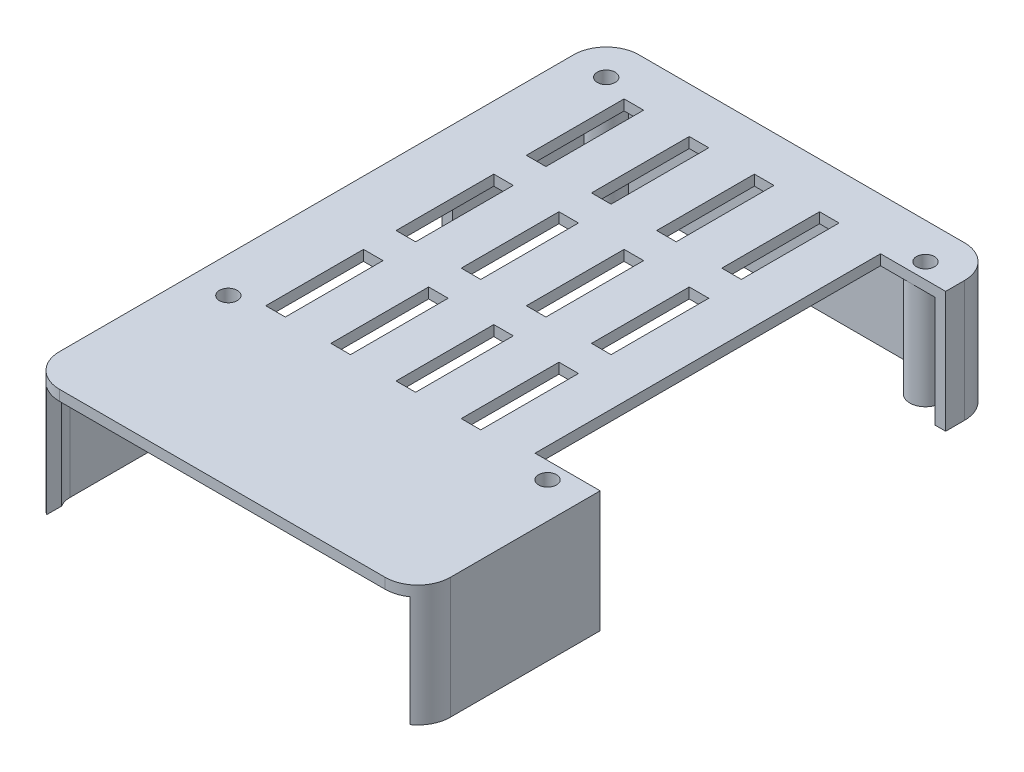
from build123d import *

# Parameters (mm, degrees)
SKETCH1_R           = 1.375
BOSS_EXTRUDE1_DEPTH = 1.6
BOSS_EXTRUDE2_START = -17
BOSS_EXTRUDE2_DEPTH = 17
BOSS_EXTRUDE3_START = -17.6
SKETCH2_R           = 2.4
SKETCH2_R_2         = 1.375
BOSS_EXTRUDE3_DEPTH = 17.6
SKETCH3_W           = 36.288172123
SKETCH3_H           = 9.00941151
CUT_EXTRUDE1_DEPTH  = 10
SKETCH5_W           = 16.770268593
SKETCH5_H           = 4.911067329
CUT_EXTRUDE2_DEPTH  = 10
SKETCH7_W           = 55
SKETCH7_H           = 17
CUT_EXTRUDE3_DEPTH  = 10
SKETCH9_W           = 3
SKETCH9_H           = 15
CUT_EXTRUDE4_DEPTH  = 10
MOVE_FACE1_BY       = 0.4
MOVE_FACE1_2_BY     = 0.4
MOVE_FACE1_3_BY     = 0.4
MOVE_FACE1_4_BY     = 0.4
MOVE_FACE1_5_BY     = 0.4
MOVE_FACE1_6_BY     = 0.4
MOVE_FACE1_7_BY     = 0.4
MOVE_FACE1_8_BY     = 0.4
MOVE_FACE1_9_BY     = 0.4
MOVE_FACE1_10_BY    = 0.4


with BuildPart() as part:
    # Sketch1 → Boss-Extrude1 (new body)
    # profile 1 of 2: a face of its own
    with BuildSketch(Plane(origin=(0, 0, 0), x_dir=(1, 0, 0), z_dir=(0, 1, 0))):
        with BuildLine():
            Line((-11.124120265, 42.72781091), (38.875879735, 42.72781091))
            ThreePointArc((38.875879735, 42.72781091), (40.997200079, 41.849131254), (41.875879735, 39.72781091))
            Line((41.875879735, 39.72781091), (41.875879735, 36.821646567))
            Line((41.875879735, 36.821646567), (33.875879735, 36.821646567))
            Line((33.875879735, 36.821646567), (33.875879735, -16.202520779))
            Line((33.875879735, -16.202520779), (41.875879735, -16.202520779))
            Line((41.875879735, -16.202520779), (41.875879735, -39.202520779))
            ThreePointArc((41.875879735, -39.202520779), (40.997200079, -41.323841123), (38.875879735, -42.202520779))
            Line((38.875879735, -42.202520779), (-11.124120265, -42.202520779))
            ThreePointArc((-11.124120265, -42.202520779), (-13.245440608, -41.323841123), (-14.124120265, -39.202520779))
            Line((-14.124120265, -39.202520779), (-14.124120265, 39.72781091))
            ThreePointArc((-14.124120265, 39.72781091), (-13.245440608, 41.849131254), (-11.124120265, 42.72781091))
        make_face()
        with Locations(Location((-10.624120265, -18.778353433, 0), (0, 0, 270))):
            Circle(SKETCH1_R, mode=Mode.SUBTRACT)
        with Locations(Location((-10.624120265, 39.221646567, 0), (0, 0, 270))):
            Circle(SKETCH1_R, mode=Mode.SUBTRACT)
        with Locations(Location((38.375879735, 39.221646567, 0), (0, 0, 270))):
            Circle(SKETCH1_R, mode=Mode.SUBTRACT)
        with Locations(Location((38.375879735, -18.778353433, 0), (0, 0, 270))):
            Circle(SKETCH1_R, mode=Mode.SUBTRACT)
    # profile 2 of 2: a face of its own
    with BuildSketch(Plane(origin=(0, 0, 0), x_dir=(1, 0, 0), z_dir=(0, 1, 0))):
        with BuildLine():
            Line((-16.124120265, -39.202520779), (-16.124120265, 39.72781091))
            ThreePointArc((-16.124120265, 39.72781091), (-14.65965417, 43.263344816), (-11.124120265, 44.72781091))
            Line((-11.124120265, 44.72781091), (38.875879735, 44.72781091))
            ThreePointArc((38.875879735, 44.72781091), (42.411413641, 43.263344816), (43.875879735, 39.72781091))
            Line((43.875879735, 39.72781091), (43.875879735, 36.821646567))
            Line((43.875879735, 36.821646567), (41.875879735, 36.821646567))
            Line((41.875879735, 36.821646567), (41.875879735, 39.72781091))
            ThreePointArc((41.875879735, 39.72781091), (40.997200079, 41.849131254), (38.875879735, 42.72781091))
            Line((38.875879735, 42.72781091), (-11.124120265, 42.72781091))
            ThreePointArc((-11.124120265, 42.72781091), (-13.245440608, 41.849131254), (-14.124120265, 39.72781091))
            Line((-14.124120265, 39.72781091), (-14.124120265, -39.202520779))
            ThreePointArc((-14.124120265, -39.202520779), (-13.245440608, -41.323841123), (-11.124120265, -42.202520779))
            Line((-11.124120265, -42.202520779), (38.875879735, -42.202520779))
            ThreePointArc((38.875879735, -42.202520779), (40.997200079, -41.323841123), (41.875879735, -39.202520779))
            Line((41.875879735, -39.202520779), (41.875879735, -16.202520779))
            Line((41.875879735, -16.202520779), (43.875879735, -16.202520779))
            Line((43.875879735, -16.202520779), (43.875879735, -39.202520779))
            ThreePointArc((43.875879735, -39.202520779), (42.411413641, -42.738054685), (38.875879735, -44.202520779))
            Line((38.875879735, -44.202520779), (-11.124120265, -44.202520779))
            ThreePointArc((-11.124120265, -44.202520779), (-14.65965417, -42.738054685), (-16.124120265, -39.202520779))
        make_face()
    extrude(amount=BOSS_EXTRUDE1_DEPTH)

    # Sketch1<3> → Boss-Extrude2 (add)
    with BuildSketch(Plane(origin=(0, 0, 0), x_dir=(1, 0, 0), z_dir=(0, 1, 0)).offset(BOSS_EXTRUDE2_START)):
        with BuildLine():
            Line((-16.124120265, -39.202520779), (-16.124120265, 39.72781091))
            ThreePointArc((-16.124120265, 39.72781091), (-14.65965417, 43.263344816), (-11.124120265, 44.72781091))
            Line((-11.124120265, 44.72781091), (38.875879735, 44.72781091))
            ThreePointArc((38.875879735, 44.72781091), (42.411413641, 43.263344816), (43.875879735, 39.72781091))
            Line((43.875879735, 39.72781091), (43.875879735, 36.821646567))
            Line((43.875879735, 36.821646567), (41.875879735, 36.821646567))
            Line((41.875879735, 36.821646567), (41.875879735, 39.72781091))
            ThreePointArc((41.875879735, 39.72781091), (40.997200079, 41.849131254), (38.875879735, 42.72781091))
            Line((38.875879735, 42.72781091), (-11.124120265, 42.72781091))
            ThreePointArc((-11.124120265, 42.72781091), (-13.245440608, 41.849131254), (-14.124120265, 39.72781091))
            Line((-14.124120265, 39.72781091), (-14.124120265, -39.202520779))
            ThreePointArc((-14.124120265, -39.202520779), (-13.245440608, -41.323841123), (-11.124120265, -42.202520779))
            Line((-11.124120265, -42.202520779), (38.875879735, -42.202520779))
            ThreePointArc((38.875879735, -42.202520779), (40.997200079, -41.323841123), (41.875879735, -39.202520779))
            Line((41.875879735, -39.202520779), (41.875879735, -16.202520779))
            Line((41.875879735, -16.202520779), (43.875879735, -16.202520779))
            Line((43.875879735, -16.202520779), (43.875879735, -39.202520779))
            ThreePointArc((43.875879735, -39.202520779), (42.411413641, -42.738054685), (38.875879735, -44.202520779))
            Line((38.875879735, -44.202520779), (-11.124120265, -44.202520779))
            ThreePointArc((-11.124120265, -44.202520779), (-14.65965417, -42.738054685), (-16.124120265, -39.202520779))
        make_face()
    extrude(amount=BOSS_EXTRUDE2_DEPTH)

    # Sketch2 → Boss-Extrude3 (add)
    # profile 1 of 4: a face of its own
    with BuildSketch(Plane(origin=(0, 1.6, 0), x_dir=(1, 0, 0), z_dir=(0, 1, 0)).offset(BOSS_EXTRUDE3_START)):
        with Locations(Location((38.375879735, 39.221646567, 0), (0, 0, 270))):
            Circle(SKETCH2_R)
        with Locations(Location((38.375879735, 39.221646567, 0), (0, 0, 270))):
            Circle(SKETCH2_R_2, mode=Mode.SUBTRACT)
    # profile 2 of 4: a face of its own
    with BuildSketch(Plane(origin=(0, 1.6, 0), x_dir=(1, 0, 0), z_dir=(0, 1, 0)).offset(BOSS_EXTRUDE3_START)):
        with Locations(Location((38.375879735, -18.778353433, 0), (0, 0, 270))):
            Circle(SKETCH2_R)
        with Locations(Location((38.375879735, -18.778353433, 0), (0, 0, 270))):
            Circle(SKETCH2_R_2, mode=Mode.SUBTRACT)
    # profile 3 of 4: a face of its own
    with BuildSketch(Plane(origin=(0, 1.6, 0), x_dir=(1, 0, 0), z_dir=(0, 1, 0)).offset(BOSS_EXTRUDE3_START)):
        with Locations(Location((-10.624120265, -18.778353433, 0), (0, 0, 270))):
            Circle(SKETCH2_R)
        with Locations(Location((-10.624120265, -18.778353433, 0), (0, 0, 270))):
            Circle(SKETCH2_R_2, mode=Mode.SUBTRACT)
    # profile 4 of 4: a face of its own
    with BuildSketch(Plane(origin=(0, 1.6, 0), x_dir=(1, 0, 0), z_dir=(0, 1, 0)).offset(BOSS_EXTRUDE3_START)):
        with Locations(Location((-10.624120265, 39.221646567, 0), (0, 0, 270))):
            Circle(SKETCH2_R)
        with Locations(Location((-10.624120265, 39.221646567, 0), (0, 0, 270))):
            Circle(SKETCH2_R_2, mode=Mode.SUBTRACT)
    extrude(amount=BOSS_EXTRUDE3_DEPTH)

    # Sketch3 → Cut-Extrude1 (cut)
    with BuildSketch(Plane(origin=(-14.124120265, 0, 0), x_dir=(0, 0, -1), z_dir=(1, 0, 0))):
        with Locations((1.373104953, -12.495294245)):
            Rectangle(SKETCH3_W, SKETCH3_H)
    extrude(amount=-CUT_EXTRUDE1_DEPTH, mode=Mode.SUBTRACT)

    # Sketch5 → Cut-Extrude2 (cut)
    with BuildSketch(Plane.ZY.offset(16.124120265)):
        with Locations((-27.902325311, -14.544466336)):
            Rectangle(SKETCH5_W, SKETCH5_H)
    extrude(amount=-CUT_EXTRUDE2_DEPTH, mode=Mode.SUBTRACT)

    # Sketch7 → Cut-Extrude3 (cut)
    with BuildSketch(Plane.XY.offset(44.202520779)):
        with Locations((13.875879735, -8.5)):
            Rectangle(SKETCH7_W, SKETCH7_H)
    extrude(amount=-CUT_EXTRUDE3_DEPTH, mode=Mode.SUBTRACT)

    # Sketch9 → Cut-Extrude4 (cut)
    with BuildSketch(Plane(origin=(0, 1.6, 0), x_dir=(1, 0, 0), z_dir=(0, 1, 0))):
        with Locations((-4.888394882, 30.22781091)):
            Rectangle(SKETCH9_W, SKETCH9_H)
        with Locations((5.111605118, 30.22781091)):
            Rectangle(SKETCH9_W, SKETCH9_H)
        with Locations((15.111605118, 30.22781091)):
            Rectangle(SKETCH9_W, SKETCH9_H)
        with Locations((25.111605118, 30.22781091)):
            Rectangle(SKETCH9_W, SKETCH9_H)
        with Locations((5.111605118, 10.22781091)):
            Rectangle(SKETCH9_W, SKETCH9_H)
        with Locations((15.111605118, 10.22781091)):
            Rectangle(SKETCH9_W, SKETCH9_H)
        with Locations((25.111605118, 10.22781091)):
            Rectangle(SKETCH9_W, SKETCH9_H)
        with Locations((5.111605118, -9.77218909)):
            Rectangle(SKETCH9_W, SKETCH9_H)
        with Locations((15.111605118, -9.77218909)):
            Rectangle(SKETCH9_W, SKETCH9_H)
        with Locations((25.111605118, -9.77218909)):
            Rectangle(SKETCH9_W, SKETCH9_H)
        with Locations((-4.888394882, 10.22781091)):
            Rectangle(SKETCH9_W, SKETCH9_H)
        with Locations((-4.888394882, -9.77218909)):
            Rectangle(SKETCH9_W, SKETCH9_H)
    extrude(amount=-CUT_EXTRUDE4_DEPTH, mode=Mode.SUBTRACT)

    # Move Face1: a face moved inward by 0.4
    extrude(part.faces().sort_by_distance((41.375879735, -8.5, 42.196740487))[0], amount=MOVE_FACE1_BY, dir=(1, 0, 0), mode=Mode.SUBTRACT)

    # Move Face1 2: a curved face moved inward by 0.4
    add(Solid.thicken(part.faces().sort_by_distance((41.748161059, -8.5, 40.068546183))[0], -MOVE_FACE1_2_BY), mode=Mode.SUBTRACT)

    # Move Face1 3: a face moved inward by 0.4
    extrude(part.faces().sort_by_distance((41.875879735, -8.5, 27.702520779))[0], amount=MOVE_FACE1_3_BY, dir=(1, 0, 0), mode=Mode.SUBTRACT)

    # Move Face1 4: a face moved inward by 0.4
    extrude(part.faces().sort_by_distance((-13.624120265, -8.5, 42.196740487))[0], amount=MOVE_FACE1_4_BY, dir=(-1, 0, 0), mode=Mode.SUBTRACT)

    # Move Face1 5: a curved face moved inward by 0.4
    add(Solid.thicken(part.faces().sort_by_distance((-13.996401588, -8.5, 40.068546183))[0], -MOVE_FACE1_5_BY), mode=Mode.SUBTRACT)

    # Move Face1 6: a face moved inward by 0.4
    extrude(part.faces().sort_by_distance((-14.124120265, -6.565433094, 2.567801751))[0], amount=MOVE_FACE1_6_BY, dir=(-1, 0, 0), mode=Mode.SUBTRACT)

    # Move Face1 7: a curved face moved inward by 0.4
    add(Solid.thicken(part.faces().sort_by_distance((-13.245440608, -8.5, -41.849131254))[0], -MOVE_FACE1_7_BY), mode=Mode.SUBTRACT)

    # Move Face1 8: a face moved inward by 0.4
    extrude(part.faces().sort_by_distance((41.875879735, -8.5, -38.274728738))[0], amount=MOVE_FACE1_8_BY, dir=(1, 0, 0), mode=Mode.SUBTRACT)

    # Move Face1 9: a curved face moved inward by 0.4
    add(Solid.thicken(part.faces().sort_by_distance((40.997200079, -8.5, -41.849131254))[0], -MOVE_FACE1_9_BY), mode=Mode.SUBTRACT)

    # Move Face1 10: a face moved inward by 0.4
    extrude(part.faces().sort_by_distance((13.875879735, -8.5, -42.72781091))[0], amount=MOVE_FACE1_10_BY, dir=(0, 0, -1), mode=Mode.SUBTRACT)


solid = part.part
